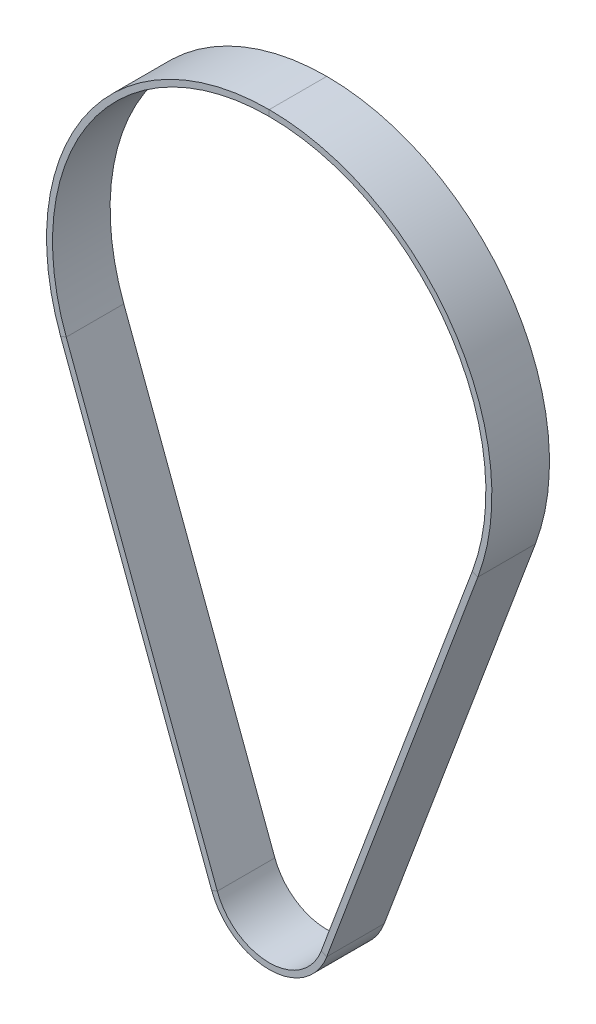
from build123d import *

# Parameters (mm, degrees)
SKETCH_2_W = 15
SKETCH_2_H = 1.56


with BuildPart() as part:
    # По траектории1: sweep along a path in Эскиз1
    with BuildLine(Plane.XY) as sweep_1_path:
        Line((-54.331482586, -20.3), (-14.987995196, -125.6))
        ThreePointArc((-14.987995196, -125.6), (0, -136), (14.987995196, -125.6))
        Line((14.987995196, -125.6), (54.331482586, -20.3))
        ThreePointArc((54.331482586, -20.3), (0, 58), (-54.331482586, -20.3))
    # Эскиз2 → По траектории1 (sweep)
    with BuildSketch(Plane(origin=(0, 0, 0), x_dir=(0, 0, -1), z_dir=(1, 0, 0))):
        with Locations((-7.5, 57.22)):
            Rectangle(SKETCH_2_W, SKETCH_2_H)
    sweep(path=sweep_1_path.line)


solid = part.part
